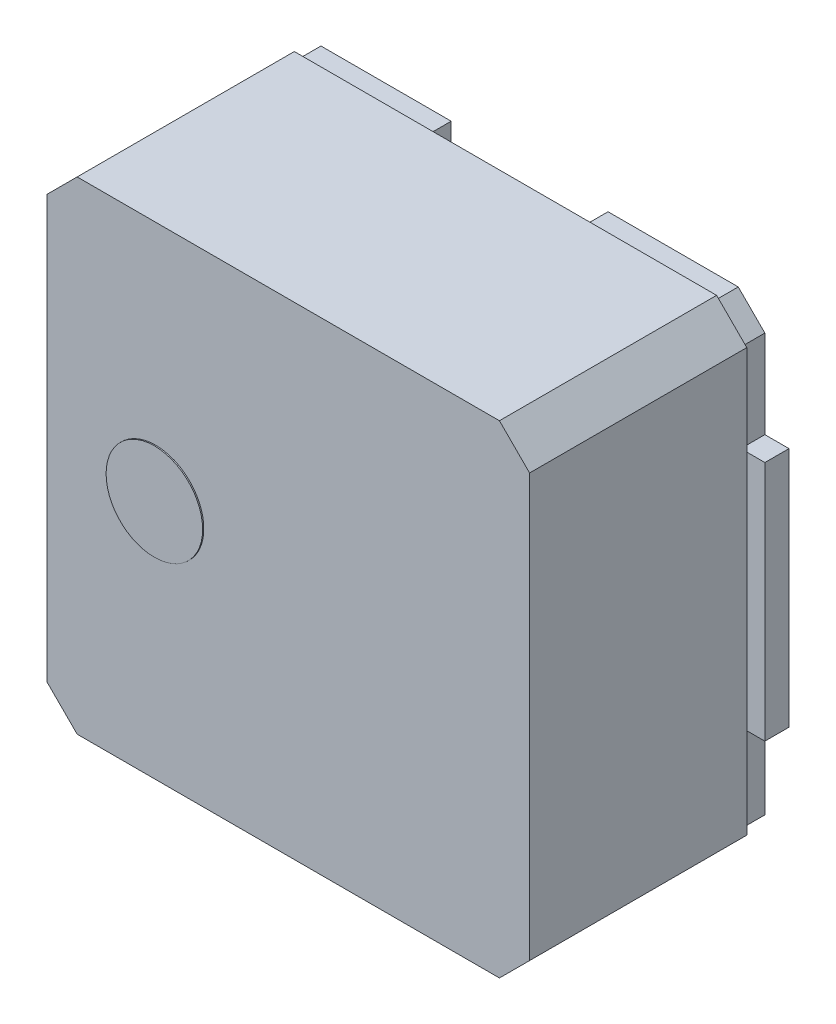
from build123d import *

# Parameters (mm, degrees)
BODY_START  = 0.2
BODY_DEPTH  = 1.8
PINS_DEPTH  = 0.2
ESQUISSE3_R = 0.4
MARK_DEPTH  = 0.01


with BuildPart() as part:
    # Esquisse1 → body (new body)
    with BuildSketch(Plane.XY.offset(BODY_START)):
        Polygon((2, -1.75), (2, 1.75), (1.75, 2), (-1.75, 2), (-2, 1.75), (-2, -1.75), (-1.75, -2), (1.75, -2), align=None)
    extrude(amount=BODY_DEPTH)

    # Esquisse2 → pins (add)
    with BuildSketch(Plane.XY):
        Polygon((0.65, 1.95), (0.65, -1.95), (1.729289322, -1.95), (1.95, -1.729289322), (1.95, -1), (2.15, -1), (2.15, 1), (1.95, 1), (1.95, 1.729289322), (1.729289322, 1.95), align=None)
        Polygon((-0.65, 1.95), (-0.65, -1.95), (-1.729289322, -1.95), (-1.95, -1.729289322), (-1.95, -1), (-2.15, -1), (-2.15, 1), (-1.95, 1), (-1.95, 1.729289322), (-1.729289322, 1.95), align=None)
    extrude(amount=PINS_DEPTH)

    # Esquisse3 → mark (add)
    with BuildSketch(Plane.XY.offset(2)):
        with Locations(Location((-1.1, 0, 0), (0, 0, 180))):
            Circle(ESQUISSE3_R)
    extrude(amount=MARK_DEPTH)


solid = part.part
